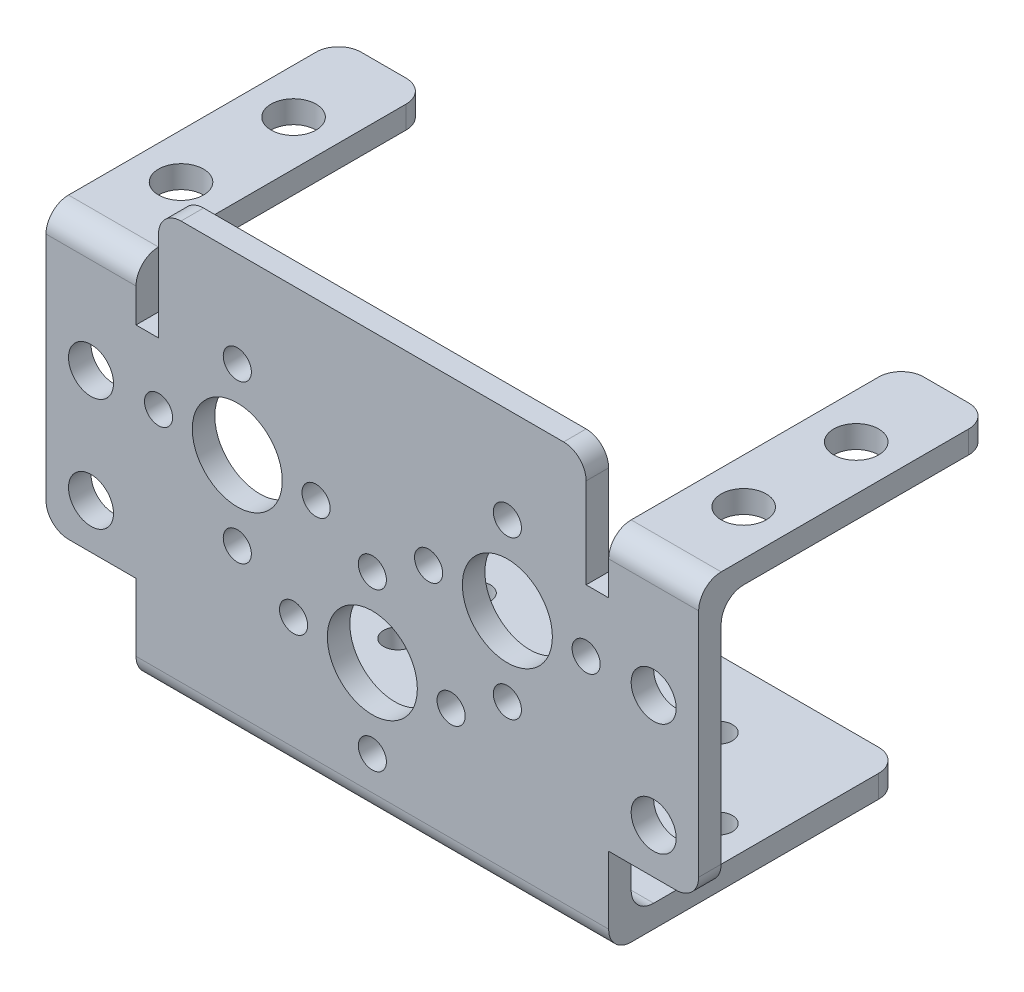
from build123d import *

# Parameters (mm, degrees)
SKETCH_1_W      = 42
SKETCH_1_H      = 26
SKETCH_1_R      = 1.25
EXTRUDE_1_DEPTH = 2
SKETCH_2_R      = 4
SKETCH_2_R_2    = 1.25
SKETCH_2_R_3    = 2
EXTRUDE_2_DEPTH = 2
SKETCH_3_W      = 8
SKETCH_3_H      = 26
SKETCH_3_R      = 2
EXTRUDE_3_DEPTH = 2
FILLET_1_R      = 2


with BuildPart() as part:
    # 草图1 → 凸台-拉伸1 (new body)
    with BuildSketch(Plane(origin=(0, 0, 0), x_dir=(1, 0, 0), z_dir=(0, 1, 0))):
        Rectangle(SKETCH_1_W, SKETCH_1_H)
        with Locations(Location((10.75, 0, 0), (0, 0, 270))):
            Circle(SKETCH_1_R, mode=Mode.SUBTRACT)
        with Locations(Location((3.75, 0, 0), (0, 0, 270))):
            Circle(SKETCH_1_R, mode=Mode.SUBTRACT)
        with Locations(Location((10.75, 7, 0), (0, 0, 270))):
            Circle(SKETCH_1_R, mode=Mode.SUBTRACT)
        with Locations(Location((17.75, 0, 0), (0, 0, 270))):
            Circle(SKETCH_1_R, mode=Mode.SUBTRACT)
        with Locations(Location((10.75, -7, 0), (0, 0, 270))):
            Circle(SKETCH_1_R, mode=Mode.SUBTRACT)
        with Locations(Location((-10.75, -7, 0), (0, 0, 90))):
            Circle(SKETCH_1_R, mode=Mode.SUBTRACT)
        with Locations(Location((-17.75, 0, 0), (0, 0, 90))):
            Circle(SKETCH_1_R, mode=Mode.SUBTRACT)
        with Locations(Location((-10.75, 0, 0), (0, 0, 90))):
            Circle(SKETCH_1_R, mode=Mode.SUBTRACT)
        with Locations(Location((-10.75, 7, 0), (0, 0, 90))):
            Circle(SKETCH_1_R, mode=Mode.SUBTRACT)
        with Locations(Location((-3.75, 0, 0), (0, 0, 90))):
            Circle(SKETCH_1_R, mode=Mode.SUBTRACT)
    extrude(amount=EXTRUDE_1_DEPTH)

    # 草图2 → 凸台-拉伸2 (add)
    with BuildSketch(Plane.XY.offset(13)):
        Polygon((21, 0), (-21, 0), (-21, 8), (-29, 8), (-29, 32.5), (-21, 32.5), (-21, 27.5), (-19, 27.5), (-19, 37.5), (0, 37.5), (19, 37.5), (19, 27.5), (21, 27.5), (21, 32.5), (29, 32.5), (29, 8), (21, 8), align=None)
        with Locations((0, 12)):
            Circle(SKETCH_2_R, mode=Mode.SUBTRACT)
        with Locations((0, 19)):
            Circle(SKETCH_2_R_2, mode=Mode.SUBTRACT)
        with Locations((7, 12)):
            Circle(SKETCH_2_R_2, mode=Mode.SUBTRACT)
        with Locations((0, 5)):
            Circle(SKETCH_2_R_2, mode=Mode.SUBTRACT)
        with Locations((-7, 12)):
            Circle(SKETCH_2_R_2, mode=Mode.SUBTRACT)
        with Locations((12, 22)):
            Circle(SKETCH_2_R, mode=Mode.SUBTRACT)
        with Locations((12, 29)):
            Circle(SKETCH_2_R_2, mode=Mode.SUBTRACT)
        with Locations((19, 22)):
            Circle(SKETCH_2_R_2, mode=Mode.SUBTRACT)
        with Locations((12, 15)):
            Circle(SKETCH_2_R_2, mode=Mode.SUBTRACT)
        with Locations((5, 22)):
            Circle(SKETCH_2_R_2, mode=Mode.SUBTRACT)
        with Locations(Location((-19, 22, 0), (0, 0, 180))):
            Circle(SKETCH_2_R_2, mode=Mode.SUBTRACT)
        with Locations(Location((-12, 15, 0), (0, 0, 180))):
            Circle(SKETCH_2_R_2, mode=Mode.SUBTRACT)
        with Locations(Location((-12, 22, 0), (0, 0, 180))):
            Circle(SKETCH_2_R, mode=Mode.SUBTRACT)
        with Locations(Location((-5, 22, 0), (0, 0, 180))):
            Circle(SKETCH_2_R_2, mode=Mode.SUBTRACT)
        with Locations(Location((-12, 29, 0), (0, 0, 180))):
            Circle(SKETCH_2_R_2, mode=Mode.SUBTRACT)
        with Locations((-25, 22)):
            Circle(SKETCH_2_R_3, mode=Mode.SUBTRACT)
        with Locations((-25, 12)):
            Circle(SKETCH_2_R_3, mode=Mode.SUBTRACT)
        with Locations(Location((25, 12, 0), (0, 0, 180))):
            Circle(SKETCH_2_R_3, mode=Mode.SUBTRACT)
        with Locations(Location((25, 22, 0), (0, 0, 180))):
            Circle(SKETCH_2_R_3, mode=Mode.SUBTRACT)
    extrude(amount=-EXTRUDE_2_DEPTH)

    # 草图3 → 凸台-拉伸3 (add)
    # profile 1 of 2: a face of its own
    with BuildSketch(Plane(origin=(0, 32.5, 0), x_dir=(1, 0, 0), z_dir=(0, 1, 0))):
        with Locations((-25, 0)):
            Rectangle(SKETCH_3_W, SKETCH_3_H)
        with Locations(Location((-25, 5, 0), (0, 0, 270))):
            Circle(SKETCH_3_R, mode=Mode.SUBTRACT)
        with Locations(Location((-25, -5, 0), (0, 0, 270))):
            Circle(SKETCH_3_R, mode=Mode.SUBTRACT)
    # profile 2 of 2: a face of its own
    with BuildSketch(Plane(origin=(0, 32.5, 0), x_dir=(1, 0, 0), z_dir=(0, 1, 0))):
        with Locations((25, 0)):
            Rectangle(SKETCH_3_W, SKETCH_3_H)
        with Locations(Location((25, -5, 0), (0, 0, 90))):
            Circle(SKETCH_3_R, mode=Mode.SUBTRACT)
        with Locations(Location((25, 5, 0), (0, 0, 90))):
            Circle(SKETCH_3_R, mode=Mode.SUBTRACT)
    extrude(amount=-EXTRUDE_3_DEPTH)

    # 圆角1
    fillet_1_edges = [part.edges().sort_by_distance(p)[0] for p in [
        (-25, 30.5, 11),
        (-29, 31.5, -13),
        (-21, 31.5, -13),
        (25, 30.5, 11),
        (21, 31.5, -13),
        (29, 31.5, -13),
        (0, 0, 13),
        (-29, 8, 12),
        (-19, 37.5, 12),
        (19, 37.5, 12),
        (29, 8, 12),
        (0, 2, 11),
        (25, 32.5, 13),
        (-25, 32.5, 13),
        (-21, 1, -13),
        (21, 1, -13),
    ]]
    fillet(fillet_1_edges, radius=FILLET_1_R)


solid = part.part
